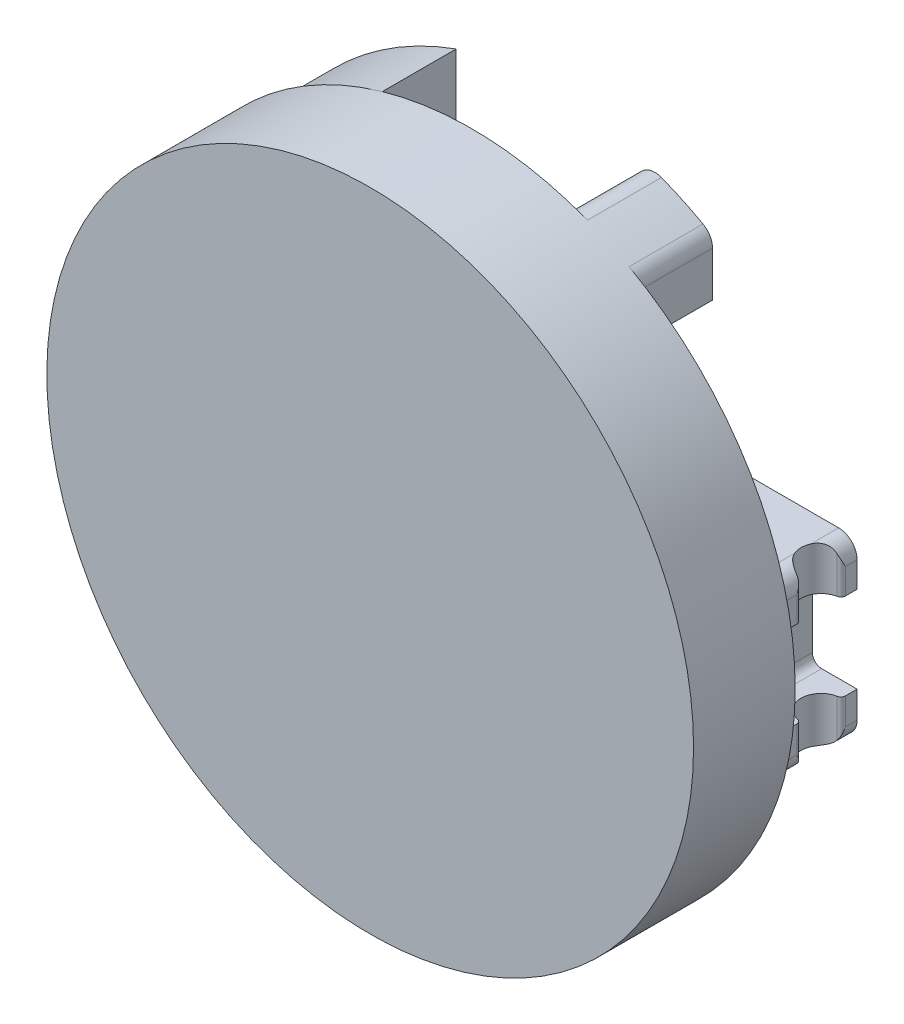
from build123d import *

# Parameters (mm, degrees)
SKETCH1_R               = 35
BOSS_EXTRUDE1_DEPTH     = 11
BOSS_EXTRUDE2_START     = 8
SKETCH2_W               = 9.919125271
SKETCH2_H               = 19.24261003
BOSS_EXTRUDE2_DEPTH     = 8
SKETCH4_W               = 19.49756264
SKETCH4_H               = 18.874094786
BOSS_EXTRUDE3_DEPTH     = 8
SKETCH6_R               = 5.918890508
CUT_EXTRUDE1_DEPTH      = 5
CUT_EXTRUDE4_DEPTH      = 16
CUT_EXTRUDE4_DEPTH_BACK = 5


with BuildPart() as part:
    # Sketch1 → Boss-Extrude1 (new body)
    with BuildSketch(Plane.XY):
        Circle(SKETCH1_R)
    extrude(amount=BOSS_EXTRUDE1_DEPTH)

    # Sketch2 → Boss-Extrude2 (add)
    with BuildSketch(Plane(origin=(0, 0, 0), x_dir=(-1, 0, 0), z_dir=(0, 0, -1)).offset(BOSS_EXTRUDE2_START)):
        with BuildLine():
            Line((-18.0511494, 9.437047393), (-31.70374069, 9.437047393))
            ThreePointArc((-31.70374069, 9.437047393), (-33.117954252, 8.851260956), (-33.70374069, 7.437047393))
            Line((-33.70374069, 7.437047393), (-33.70374069, 4.679927622))
            Line((-33.70374069, 4.679927622), (-29.859553671, 4.679927622))
            ThreePointArc((-29.859553671, 4.679927622), (-29.15244689, 4.387034403), (-28.859553671, 3.679927622))
            Line((-28.859553671, 3.679927622), (-28.859553671, 0))
            Line((-28.859553671, 0), (-28.859553671, -3.679927622))
            ThreePointArc((-28.859553671, -3.679927622), (-29.15244689, -4.387034403), (-29.859553671, -4.679927622))
            Line((-29.859553671, -4.679927622), (-33.70374069, -4.679927622))
            Line((-33.70374069, -4.679927622), (-33.70374069, -7.582708941))
            ThreePointArc((-33.70374069, -7.582708941), (-33.117954252, -8.996922503), (-31.70374069, -9.582708941))
            Line((-31.70374069, -9.582708941), (-18.0511494, -9.582708941))
            Line((-18.0511494, -9.582708941), (-18.0511494, -9.437047393))
            ThreePointArc((-18.0511494, -9.437047393), (-10.791286921, -16.696909873), (-18.0511494, -23.956772352))
            Line((-18.0511494, -23.956772352), (-18.0511494, -28.833324521))
            ThreePointArc((-18.0511494, -28.833324521), (-17.775329476, -29.846834791), (-17.023946334, -30.580798734))
            ThreePointArc((-17.023946334, -30.580798734), (-14.809870149, -31.712264917), (-12.521051282, -32.683685147))
            ThreePointArc((-12.521051282, -32.683685147), (-10.672199785, -32.463919973), (-9.805562637, -30.816045996))
            Line((-9.805562637, -30.816045996), (-9.805562637, 9.437047393))
            Line((-9.805562637, 9.437047393), (-9.805562637, 30.816045996))
            ThreePointArc((-9.805562637, 30.816045996), (-10.672199785, 32.463919973), (-12.521051282, 32.683685147))
            ThreePointArc((-12.521051282, 32.683685147), (-14.809870149, 31.712264917), (-17.023946334, 30.580798734))
            ThreePointArc((-17.023946334, 30.580798734), (-17.775329476, 29.84683479), (-18.0511494, 28.833324521))
            Line((-18.0511494, 28.833324521), (-18.0511494, 23.956772352))
            ThreePointArc((-18.0511494, 23.956772352), (-10.791286921, 16.696909873), (-18.0511494, 9.437047393))
        make_face()
        with BuildLine():
            ThreePointArc((32.652182779, 6.91093898), (24.692534845, 23.296158989), (9.692000003, 33.631311838))
            Line((9.692000003, 33.631311838), (9.692000003, 9.437047393))
            Line((9.692000003, 9.437047393), (19.611125274, 9.437047393))
            Line((19.611125274, 9.437047393), (19.611125274, -9.805562637))
            Line((19.611125274, -9.805562637), (9.692000003, -9.805562637))
            Line((9.692000003, -9.805562637), (9.692000003, -33.631311838))
            ThreePointArc((9.692000003, -33.631311838), (24.692534845, -23.296158989), (32.652182779, -6.91093898))
            ThreePointArc((32.652182779, -6.91093898), (32.443493864, -6.082517787), (31.671050481, -5.717601419))
            Line((31.671050481, -5.717601419), (27.071040834, -5.717601419))
            ThreePointArc((27.071040834, -5.717601419), (25.656827271, -5.131814981), (25.071040834, -3.717601419))
            Line((25.071040834, -3.717601419), (25.071040834, 3.717601419))
            ThreePointArc((25.071040834, 3.717601419), (25.656827271, 5.131814981), (27.071040834, 5.717601419))
            Line((27.071040834, 5.717601419), (31.671050481, 5.717601419))
            ThreePointArc((31.671050481, 5.717601419), (32.443493864, 6.082517787), (32.652182779, 6.91093898))
        make_face()
        with Locations((14.651562639, -0.184257622)):
            Rectangle(SKETCH2_W, SKETCH2_H)
    extrude(amount=-BOSS_EXTRUDE2_DEPTH)

    # Sketch4 → Boss-Extrude3 (add)
    with BuildSketch(Plane(origin=(0, 0, 0), x_dir=(-1, 0, 0), z_dir=(0, 0, -1))):
        with Locations((-0.056781317, 0)):
            Rectangle(SKETCH4_W, SKETCH4_H)
    extrude(amount=BOSS_EXTRUDE3_DEPTH)

    # Sketch6 → Cut-Extrude1 (cut)
    with BuildSketch(Plane(origin=(0, 0, -8), x_dir=(-1, 0, 0), z_dir=(0, 0, -1))):
        with Locations((18.756852772, 16.696909873)):
            Circle(SKETCH6_R)
        with Locations(Location((18.756852772, -16.696909873, 0), (0, 0, 180))):
            Circle(SKETCH6_R)
    extrude(amount=-CUT_EXTRUDE1_DEPTH, mode=Mode.SUBTRACT)

    # Sketch11 → Cut-Extrude4 (cut, two sides: drawn at the far end of the back side and taken through both)
    with BuildSketch(Plane(origin=(0, 4.679927622, 0), x_dir=(-1, 0, 0), z_dir=(0, -1, 0)).offset(-CUT_EXTRUDE4_DEPTH_BACK)):
        with BuildLine():
            Line((-33.70374069, 6.745944891), (-33.70374069, 1.4705717))
            ThreePointArc((-33.70374069, 1.4705717), (-33.58881267, 1.789506757), (-33.296862408, 1.961823515))
            ThreePointArc((-33.296862408, 1.961823515), (-31.519082318, 4.108258295), (-33.296862408, 6.254693076))
            ThreePointArc((-33.296862408, 6.254693076), (-33.58881267, 6.427009834), (-33.70374069, 6.745944891))
        make_face()
    extrude(amount=CUT_EXTRUDE4_DEPTH + CUT_EXTRUDE4_DEPTH_BACK, mode=Mode.SUBTRACT)


solid = part.part
